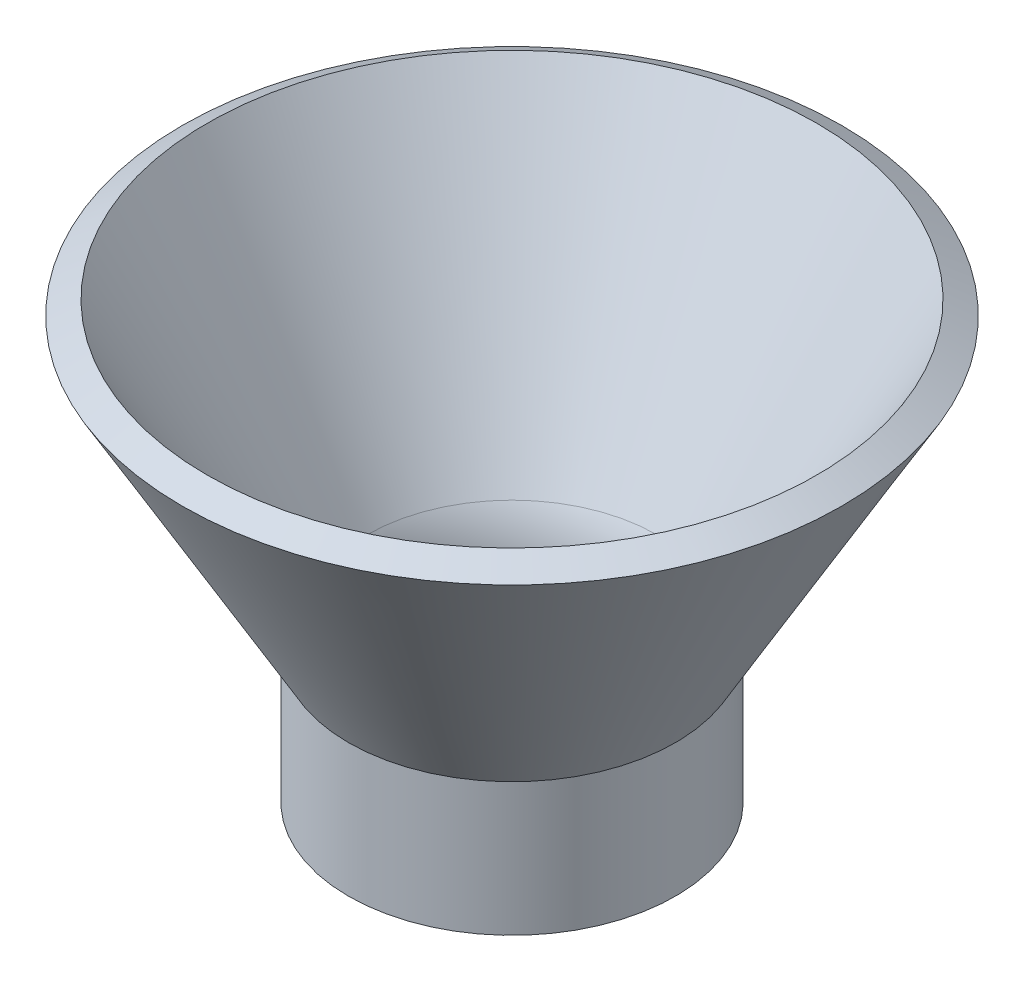
from build123d import *

# Parameters (mm, degrees)
SKETCH1_R           = 14.75
SKETCH1_R_2         = 11.75
BOSS_EXTRUDE1_DEPTH = 12
FILLET1_R           = 10


with BuildPart() as part:
    # Sketch1 → Boss-Extrude1 (new body)
    with BuildSketch(Plane(origin=(0, 0, 0), x_dir=(1, 0, 0), z_dir=(0, 1, 0))):
        with Locations(Location((0, 0, 0), (0, 0, 270))):
            Circle(SKETCH1_R)
        with Locations(Location((0, 0, 0), (0, 0, 270))):
            Circle(SKETCH1_R_2, mode=Mode.SUBTRACT)
    extrude(amount=BOSS_EXTRUDE1_DEPTH)

    # Sketch2 → Revolve1 (revolve)
    with BuildSketch(Plane.XY, mode=Mode.PRIVATE) as revolve1_sk:
        Polygon((-14.75, 12), (-29.75, 37.980762114), (-27.5, 39.279800219), (-11.75, 12), align=None)
    revolve(revolve1_sk.sketch.rotate(Axis((0, 0, 0), (0, 1, 0)), 270), axis=Axis((0, 0, 0), (0, 1, 0)))

    # Fillet1
    fillet1_edges = [part.edges().sort_by_distance(p)[0] for p in [
        (-11.75, 12, 0),
    ]]
    fillet(fillet1_edges, radius=FILLET1_R)


solid = part.part
